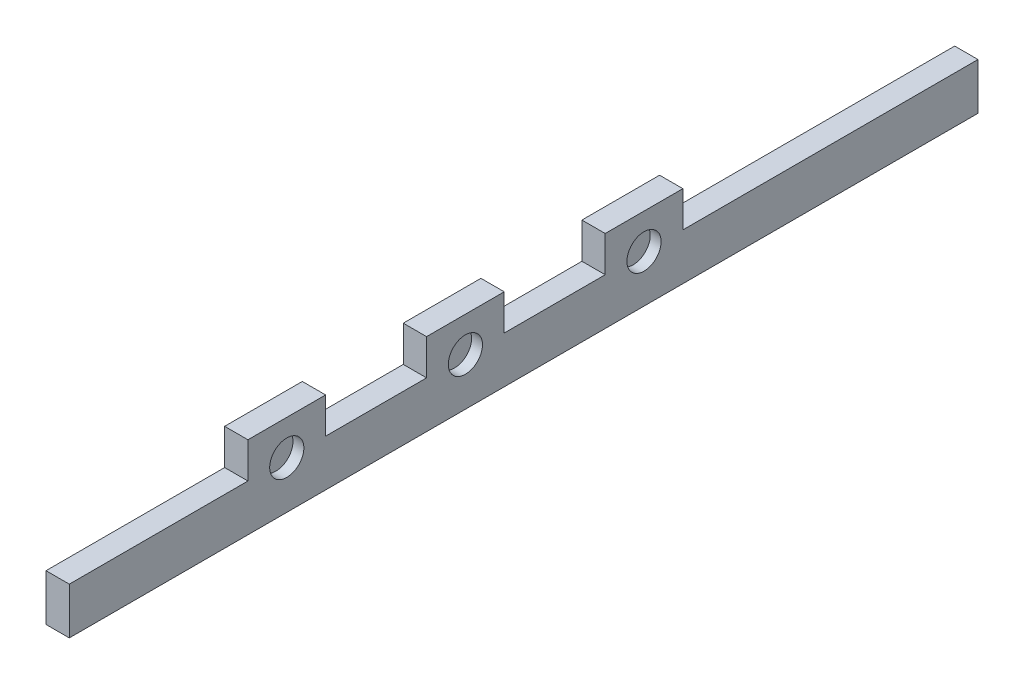
from build123d import *

# Parameters (mm, degrees)
SALIENTE_EXTRUIR1_DEPTH = 15
CROQUIS2_R              = 11
CORTAR_EXTRUIR1_DEPTH   = 7


with BuildPart() as part:
    # Croquis1 → Saliente-Extruir1 (new body)
    with BuildSketch(Plane(origin=(0, 0, 0), x_dir=(0, 0, -1), z_dir=(1, 0, 0))):
        Polygon((-292.5, 0), (292.5, 0), (292.5, 30), (102.5, 30), (102.5, 53), (52.5, 53), (52.5, 30), (-12.5, 30), (-12.5, 53), (-62.5, 53), (-62.5, 30), (-127.5, 30), (-127.5, 53), (-177.5, 53), (-177.5, 30), (-292.5, 30), align=None)
    extrude(amount=SALIENTE_EXTRUIR1_DEPTH)

    # Croquis2 → Cortar-Extruir1 (cut)
    with BuildSketch(Plane(origin=(15, 0, 0), x_dir=(0, 0, -1), z_dir=(1, 0, 0))):
        with Locations((-37.5, 30.5)):
            Circle(CROQUIS2_R)
        with Locations((-152.5, 30.5)):
            Circle(CROQUIS2_R)
        with Locations((77.5, 30.5)):
            Circle(CROQUIS2_R)
    extrude(amount=-CORTAR_EXTRUIR1_DEPTH, mode=Mode.SUBTRACT)


solid = part.part
